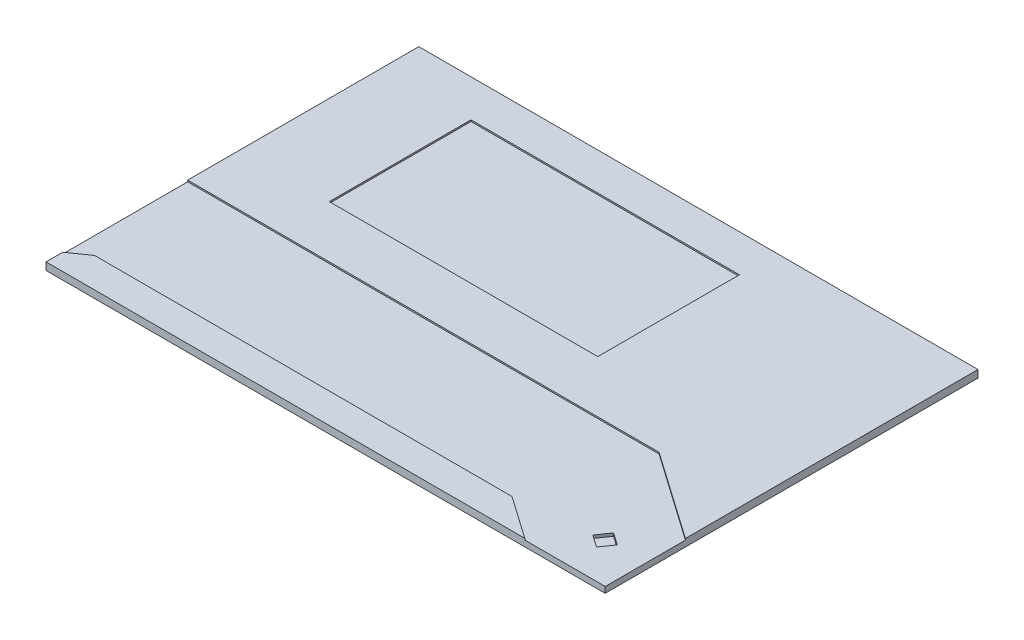
from build123d import *

# Parameters (mm, degrees)
CROQUIS3_W              = 750
CROQUIS3_H              = 500
SALIENTE_EXTRUIR1_DEPTH = 10
CROQUIS5_W              = 360
CROQUIS5_H              = 190
CORTAR_EXTRUIR2_DEPTH   = 2
CORTAR_EXTRUIR3_DEPTH   = 4
CROQUIS8_W              = 50
CROQUIS8_H              = 26.360948023
SALIENTE_EXTRUIR2_DEPTH = 15
CROQUIS9_W              = 160
CROQUIS9_H              = 52
SALIENTE_EXTRUIR3_DEPTH = 10


with BuildPart() as part:
    # Croquis3 → Saliente-Extruir1 (new body)
    with BuildSketch(Plane(origin=(0, 0, 0), x_dir=(1, 0, 0), z_dir=(0, 1, 0))):
        Rectangle(CROQUIS3_W, CROQUIS3_H)
    extrude(amount=-SALIENTE_EXTRUIR1_DEPTH)

    # Croquis5 → Cortar-Extruir2 (cut)
    with BuildSketch(Plane(origin=(0, 0, 0), x_dir=(1, 0, 0), z_dir=(0, 1, 0))):
        with Locations((-75, 105)):
            Rectangle(CROQUIS5_W, CROQUIS5_H)
        Polygon((-350, -60), (210, -60), (257.294818332, -60), (375, -142.41805549), (375, -250), (267.12592027, -250), (210, -210), (-350, -210), (-375, -227.505188455), (-375, -60), align=None)
    extrude(amount=-CORTAR_EXTRUIR2_DEPTH, mode=Mode.SUBTRACT)

    # Croquis7 → Cortar-Extruir3 (cut)
    with BuildSketch(Plane(origin=(0, -2, 0), x_dir=(1, 0, 0), z_dir=(0, 1, 0))):
        Polygon((318.412529557, -182.145430387), (334.795570442, -193.616959114), (323.324041715, -210), (306.94100083, -198.528471273), align=None)
    extrude(amount=-CORTAR_EXTRUIR3_DEPTH, mode=Mode.SUBTRACT)

    # Croquis8 → Saliente-Extruir2 (add)
    with BuildSketch(Plane.XZ.offset(10)):
        with Locations((-93.677785159, -94.090467316)):
            Rectangle(CROQUIS8_W, CROQUIS8_H)
    extrude(amount=SALIENTE_EXTRUIR2_DEPTH)

    # Croquis9 → Saliente-Extruir3 (add)
    with BuildSketch(Plane.XZ.offset(10)):
        with Locations((-148.677785159, -94.090467317)):
            Rectangle(CROQUIS9_W, CROQUIS9_H)
    extrude(amount=SALIENTE_EXTRUIR3_DEPTH)


solid = part.part
